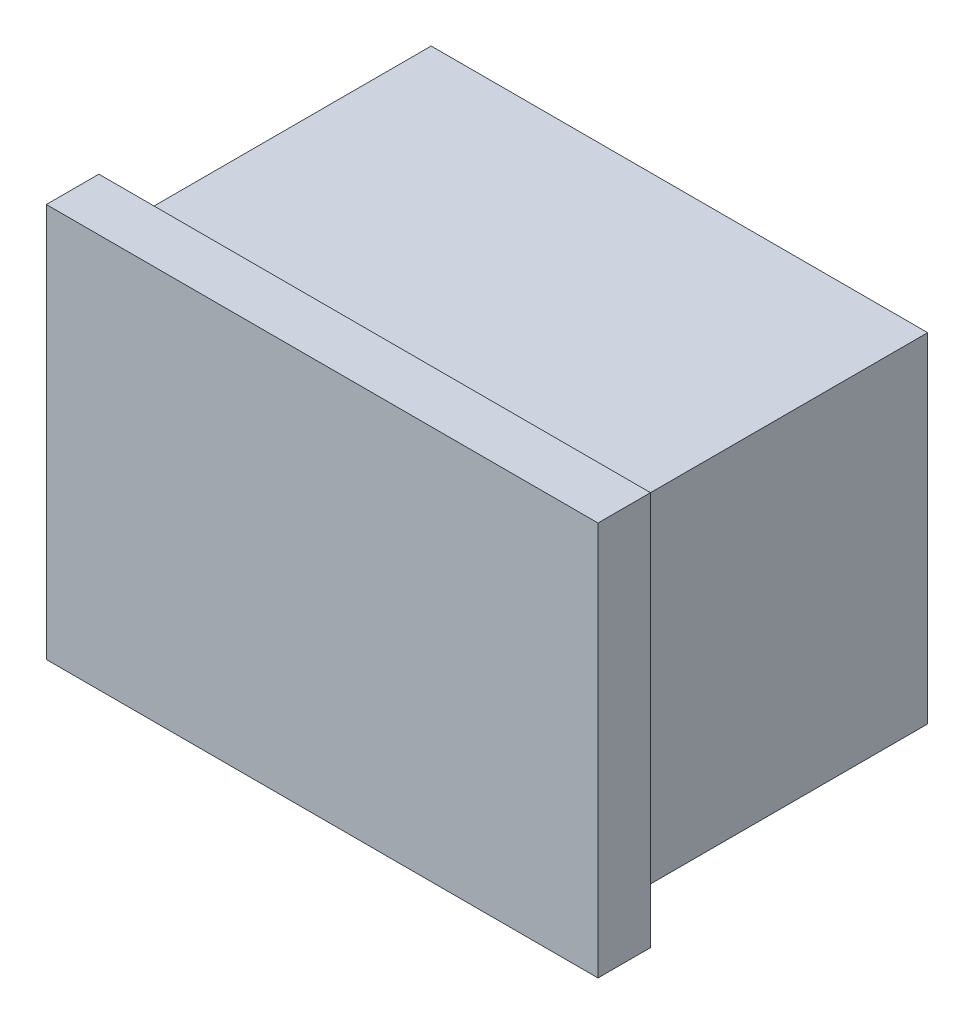
from build123d import *

# Parameters (mm, degrees)
SKETCH1_W           = 18.9
SKETCH1_H           = 12.9
BOSS_EXTRUDE1_DEPTH = 11.6
SKETCH2_W           = 21
SKETCH2_H           = 15
BOSS_EXTRUDE2_DEPTH = 2


with BuildPart() as part:
    # Sketch1 → Boss-Extrude1 (new body)
    with BuildSketch(Plane.XY):
        with Locations((9.45, 6.45)):
            Rectangle(SKETCH1_W, SKETCH1_H)
    extrude(amount=BOSS_EXTRUDE1_DEPTH)

    # Sketch2 → Boss-Extrude2 (add)
    with BuildSketch(Plane.XY.offset(11.6)):
        with Locations((9.45, 6.45)):
            Rectangle(SKETCH2_W, SKETCH2_H)
    extrude(amount=BOSS_EXTRUDE2_DEPTH)


solid = part.part
